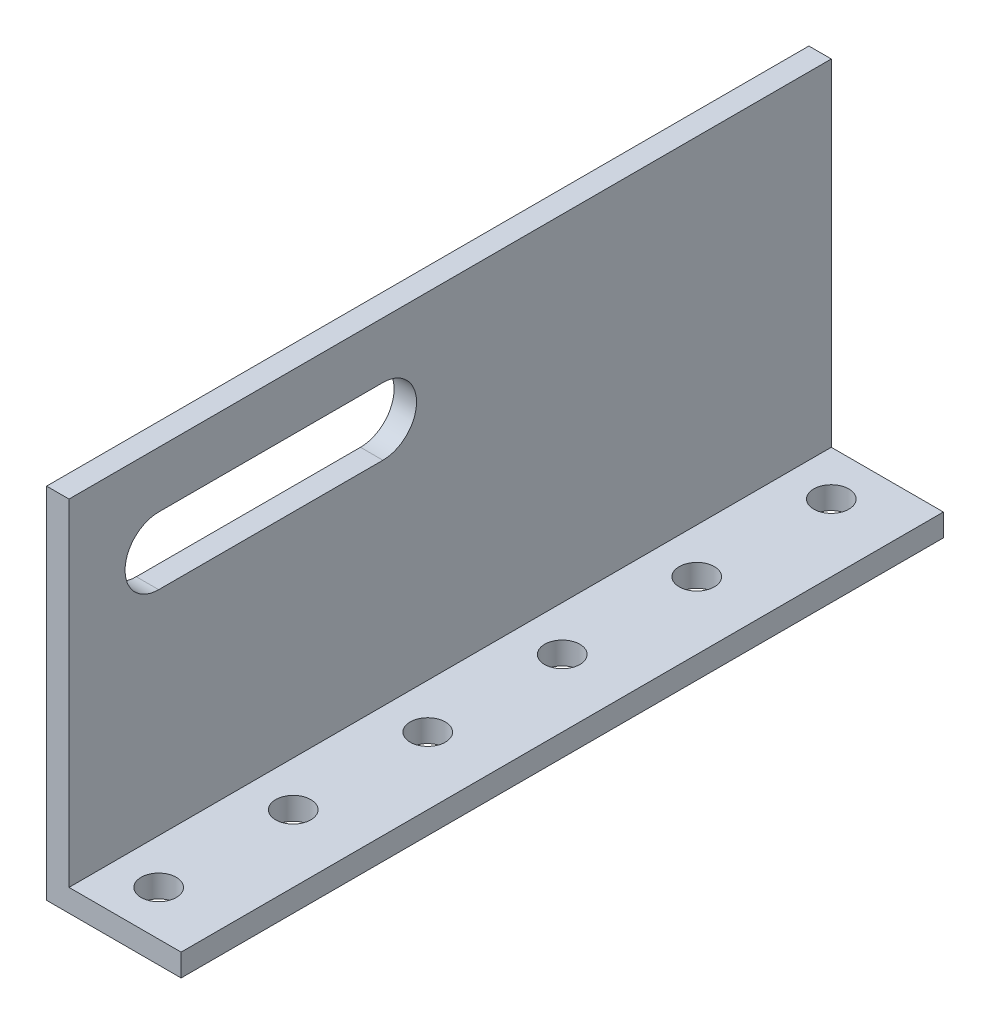
from build123d import *

# Parameters (mm, degrees)
SKETCH1_W           = 3.175
SKETCH1_H           = 47.625
SKETCH1_H_2         = 3.175
SKETCH1_W_2         = 15.875
BOSS_EXTRUDE1_DEPTH = 107.95
SKETCH2_R           = 2.4892
CUT_EXTRUDE1_DEPTH  = 107.95
CUT_EXTRUDE2_DEPTH  = 165.1


with BuildPart() as part:
    # Sketch1 → Boss-Extrude1 (new body)
    with BuildSketch(Plane.XY):
        with Locations((1.5875, 26.9875)):
            Rectangle(SKETCH1_W, SKETCH1_H)
        with Locations((1.5875, 1.5875)):
            Rectangle(SKETCH1_W, SKETCH1_H_2)
        with Locations((11.1125, 1.5875)):
            Rectangle(SKETCH1_W_2, SKETCH1_H_2)
    extrude(amount=BOSS_EXTRUDE1_DEPTH)

    # Sketch2 → Cut-Extrude1 (cut)
    with BuildSketch(Plane(origin=(0, 3.175, 0), x_dir=(1, 0, 0), z_dir=(0, 1, 0))):
        with Locations(Location((9.525, -6.35, 0), (0, 0, 270))):
            Circle(SKETCH2_R)
        with Locations(Location((9.525, -25.4, 0), (0, 0, 270))):
            Circle(SKETCH2_R)
        with Locations(Location((9.525, -44.45, 0), (0, 0, 270))):
            Circle(SKETCH2_R)
        with Locations(Location((9.525, -63.5, 0), (0, 0, 270))):
            Circle(SKETCH2_R)
        with Locations(Location((9.525, -82.55, 0), (0, 0, 270))):
            Circle(SKETCH2_R)
        with Locations(Location((9.525, -101.6, 0), (0, 0, 270))):
            Circle(SKETCH2_R)
    extrude(amount=-CUT_EXTRUDE1_DEPTH, mode=Mode.SUBTRACT)

    # Sketch3 → Cut-Extrude2 (cut)
    with BuildSketch(Plane.ZY):
        with BuildLine():
            Line((63.5, 42.8625), (95.25, 42.8625))
            ThreePointArc((95.25, 42.8625), (100.0125, 38.1), (95.25, 33.3375))
            Line((95.25, 33.3375), (63.5, 33.3375))
            ThreePointArc((63.5, 33.3375), (58.7375, 38.1), (63.5, 42.8625))
        make_face()
    extrude(amount=-CUT_EXTRUDE2_DEPTH, mode=Mode.SUBTRACT)


solid = part.part
